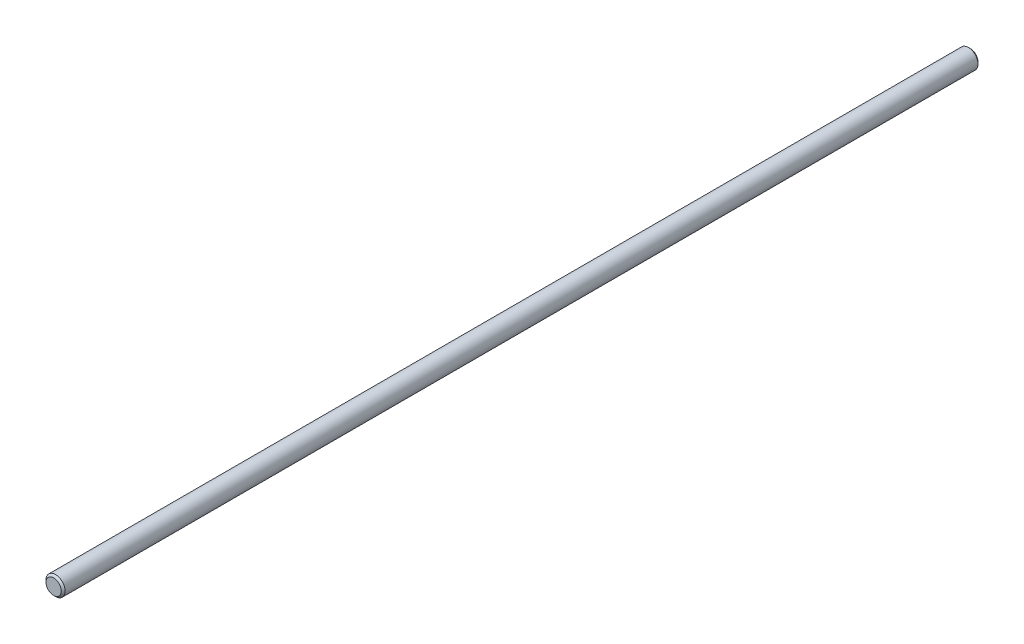
from build123d import *

# Parameters (mm, degrees)
SKETCH3_R           = 3.175
BOSS_EXTRUDE1_DEPTH = 152.4
CHAMFER1_SIZE       = 0.635


with BuildPart() as part:
    # Sketch3 → Boss-Extrude1 (new, symmetric)
    with BuildSketch(Plane.XY):
        with Locations(Location((0, 0, 0), (0, 0, 180))):
            Circle(SKETCH3_R)
    extrude(amount=BOSS_EXTRUDE1_DEPTH, both=True)

    # Chamfer1
    chamfer1_edges = [part.edges().sort_by_distance(p)[0] for p in [
        (3.175, 0, -152.4),
        (3.175, 0, 152.4),
    ]]
    chamfer(chamfer1_edges, length=CHAMFER1_SIZE)


solid = part.part
